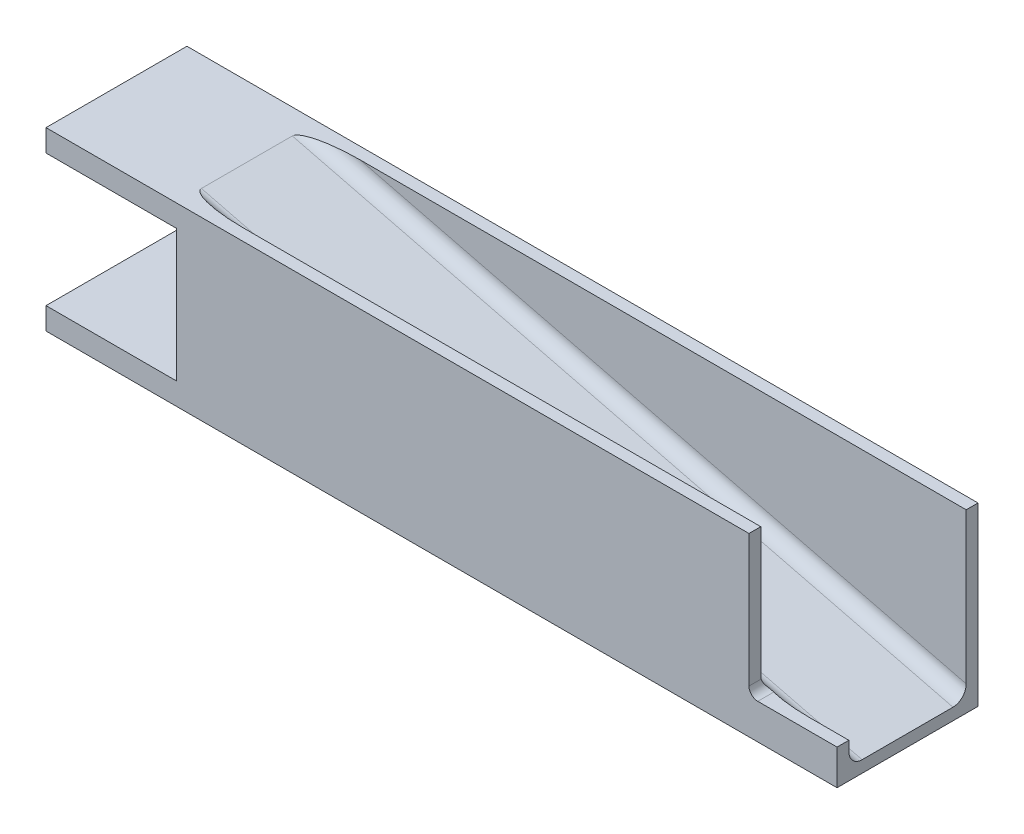
from build123d import *

# Parameters (mm, degrees)
SKETCH1_W           = 190.5
SKETCH1_H           = 40.64
BOSS_EXTRUDE1_DEPTH = 50.8
SKETCH2_W           = 33.8328
SKETCH2_H           = 53.486117269
CUT_EXTRUDE1_DEPTH  = 202.302010919
BOSS_EXTRUDE2_REACH = 191.307
SKETCH4_W           = 196.307587048
SKETCH4_H           = 33.8328
SKETCH6_W           = 25.4
SKETCH6_H           = 50.8
CUT_EXTRUDE3_DEPTH  = 202.302010919
FILLET1_R           = 3.81
SKETCH7_W           = 25.4
SKETCH7_H           = 40.64
CUT_EXTRUDE4_DEPTH  = 5.08
SKETCH8_W           = 40.64
SKETCH8_H           = 50.8
BOSS_EXTRUDE3_DEPTH = 37.592
FILLET2_R           = 2.54
SKETCH9_W           = 37.592
SKETCH9_H           = 38.1
CUT_EXTRUDE5_DEPTH  = 202.302011039


with BuildPart() as part:
    # Sketch1 → Boss-Extrude1 (new body)
    with BuildSketch(Plane(origin=(0, 0, 0), x_dir=(1, 0, 0), z_dir=(0, 1, 0))):
        with Locations((95.25, 20.32)):
            Rectangle(SKETCH1_W, SKETCH1_H)
    extrude(amount=BOSS_EXTRUDE1_DEPTH)

    # Sketch2 → Cut-Extrude1 (cut, through all)
    with BuildSketch(Plane(origin=(190.5, 0, 0), x_dir=(0, 0, -1), z_dir=(1, 0, 0))):
        with Locations((20.32, 30.146658634)):
            Rectangle(SKETCH2_W, SKETCH2_H)
    extrude(amount=-CUT_EXTRUDE1_DEPTH, mode=Mode.SUBTRACT)

    # Boss-Extrude2: up to this face of the body (flat: up to its plane)
    boss_extrude2_end = Plane(part.part.faces().sort_by_distance((95.25, 3.4036, -20.32))[0])
    # Sketch4 → Boss-Extrude2 (add, up to the picked face)
    with BuildSketch(Plane(origin=(11.902272211, 47.838714674, 0), x_dir=(0.9704158808316984, -0.24143947115092654, 0), z_dir=(0.2414394711509265, 0.9704158808316983, 0)), mode=Mode.PRIVATE) as boss_extrude2_sk1:
        with Locations((85.88866839, 20.32)):
            Rectangle(SKETCH4_W, SKETCH4_H)
    boss_extrude2_tool1 = split(extrude(boss_extrude2_sk1.sketch, amount=-BOSS_EXTRUDE2_REACH, mode=Mode.PRIVATE), bisect_by=boss_extrude2_end, keep=Keep.BOTH, mode=Mode.PRIVATE)
    add(boss_extrude2_tool1.solids().sort_by(Axis((95.25, 27.1018, -20.32), (-0.2414394711509265, -0.9704158808316983, 0)))[0])

    # Sketch6 → Cut-Extrude3 (cut, through all)
    with BuildSketch(Plane.XY):
        with Locations((-12.7, 25.4)):
            Rectangle(SKETCH6_W, SKETCH6_H)
    extrude(amount=-CUT_EXTRUDE3_DEPTH, mode=Mode.SUBTRACT)

    # Fillet1
    fillet1_edges = [part.edges().sort_by_distance(p)[0] for p in [
        (95.25, 27.1018, -3.4036),
        (95.25, 27.1018, -37.2364),
    ]]
    fillet(fillet1_edges, radius=FILLET1_R)

    # Sketch7 → Cut-Extrude4 (cut)
    with BuildSketch(Plane.XY):
        with Locations((177.8, 30.48)):
            Rectangle(SKETCH7_W, SKETCH7_H)
    extrude(amount=-CUT_EXTRUDE4_DEPTH, mode=Mode.SUBTRACT)

    # Sketch8 → Boss-Extrude3 (add)
    with BuildSketch(Plane.ZY):
        with Locations((-20.32, 25.4)):
            Rectangle(SKETCH8_W, SKETCH8_H)
    extrude(amount=BOSS_EXTRUDE3_DEPTH)

    # Fillet2
    fillet2_edges = [part.edges().sort_by_distance(p)[0] for p in [
        (165.1, 10.16, -2.54),
    ]]
    fillet(fillet2_edges, radius=FILLET2_R)

    # Sketch9 → Cut-Extrude5 (cut, through all)
    with BuildSketch(Plane.XY):
        with Locations((-18.796, 25.4)):
            Rectangle(SKETCH9_W, SKETCH9_H)
    extrude(amount=-CUT_EXTRUDE5_DEPTH, mode=Mode.SUBTRACT)


solid = part.part
